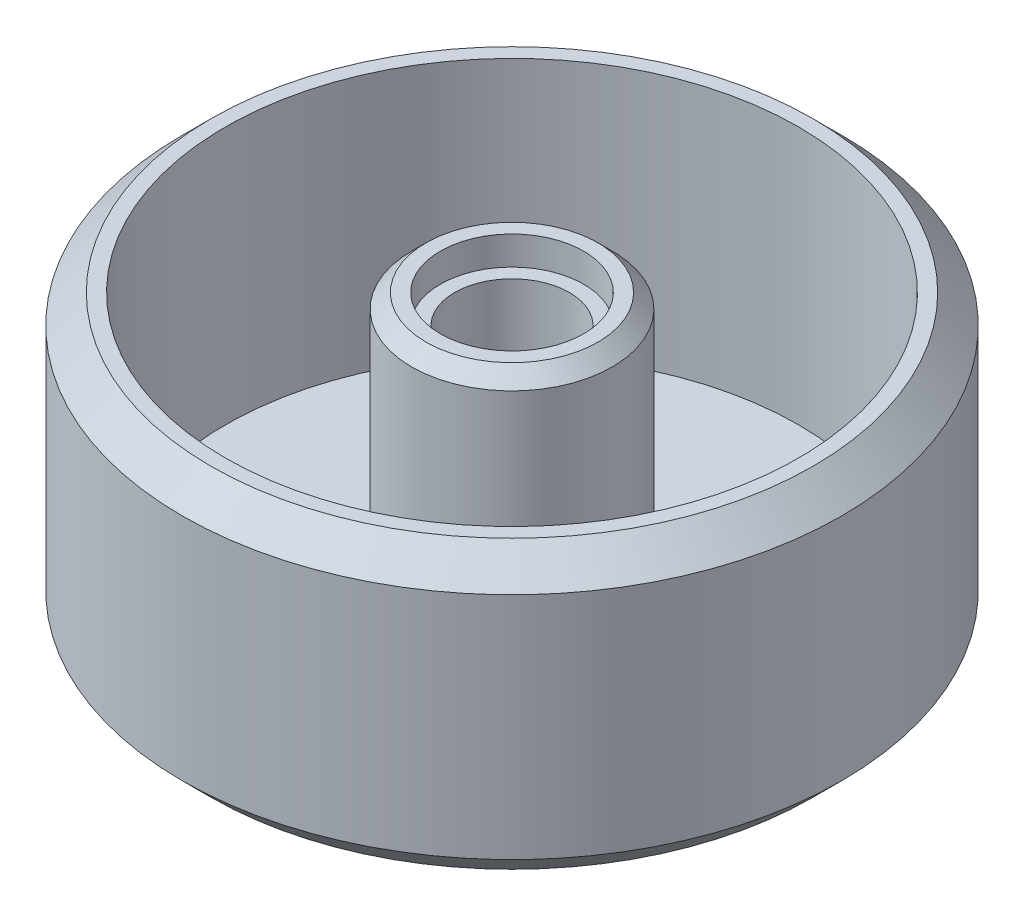
from build123d import *

# Parameters (mm, degrees)
SKETCH_1_R          = 11.5
EXTRUDE_1_DEPTH     = 10
SKETCH_2_R          = 10
SKETCH_2_R_2        = 3.5
CUT_EXTRUDE_1_DEPTH = 9
SKETCH_3_R          = 2.5
CUT_EXTRUDE_2_DEPTH = 1
CUT_EXTRUDE_START   = -1
SKETCH_4_R          = 2.5
CUT_EXTRUDE_3_DEPTH = 1
SKETCH_5_R          = 2
CUT_EXTRUDE_4_DEPTH = 19.587630295
CHAMFER_1_SIZE      = 1
CHAMFER_2_SIZE      = 0.5


with BuildPart() as part:
    # 草图1 → 凸台-拉伸1 (new body)
    with BuildSketch(Plane(origin=(0, 0, 0), x_dir=(1, 0, 0), z_dir=(0, 1, 0))):
        with Locations(Location((0, 0, 0), (0, 0, 270))):
            Circle(SKETCH_1_R)
    extrude(amount=EXTRUDE_1_DEPTH)

    # 草图2 → 切除-拉伸1 (cut)
    with BuildSketch(Plane(origin=(0, 10, 0), x_dir=(1, 0, 0), z_dir=(0, 1, 0))):
        with Locations(Location((0, 0, 0), (0, 0, 270))):
            Circle(SKETCH_2_R)
        with Locations(Location((0, 0, 0), (0, 0, 270))):
            Circle(SKETCH_2_R_2, mode=Mode.SUBTRACT)
    extrude(amount=-CUT_EXTRUDE_1_DEPTH, mode=Mode.SUBTRACT)

    # 草图3 → 切除-拉伸2 (cut)
    with BuildSketch(Plane(origin=(0, 10, 0), x_dir=(1, 0, 0), z_dir=(0, 1, 0))):
        with Locations(Location((0, 0, 0), (0, 0, 270))):
            Circle(SKETCH_3_R)
    extrude(amount=-CUT_EXTRUDE_2_DEPTH, mode=Mode.SUBTRACT)

    # 草图4 → 切除-拉伸3 (cut)
    with BuildSketch(Plane.XZ.offset(CUT_EXTRUDE_START)):
        with Locations(Location((0, 0, 0), (0, 0, 90))):
            Circle(SKETCH_4_R)
    extrude(amount=CUT_EXTRUDE_3_DEPTH, mode=Mode.SUBTRACT)

    # 草图5 → 切除-拉伸4 (cut, through all)
    with BuildSketch(Plane.XZ.offset(-1)):
        with Locations(Location((0, 0, 0), (0, 0, 270))):
            Circle(SKETCH_5_R)
    extrude(amount=-CUT_EXTRUDE_4_DEPTH, mode=Mode.SUBTRACT)

    # 倒角1
    chamfer_1_edges = [part.edges().sort_by_distance(p)[0] for p in [
        (0, 0, -11.5),
        (0, 10, -11.5),
    ]]
    chamfer(chamfer_1_edges, length=CHAMFER_1_SIZE)

    # 倒角2
    chamfer_2_edges = [part.edges().sort_by_distance(p)[0] for p in [
        (0, 10, -3.5),
    ]]
    chamfer(chamfer_2_edges, length=CHAMFER_2_SIZE)


solid = part.part
